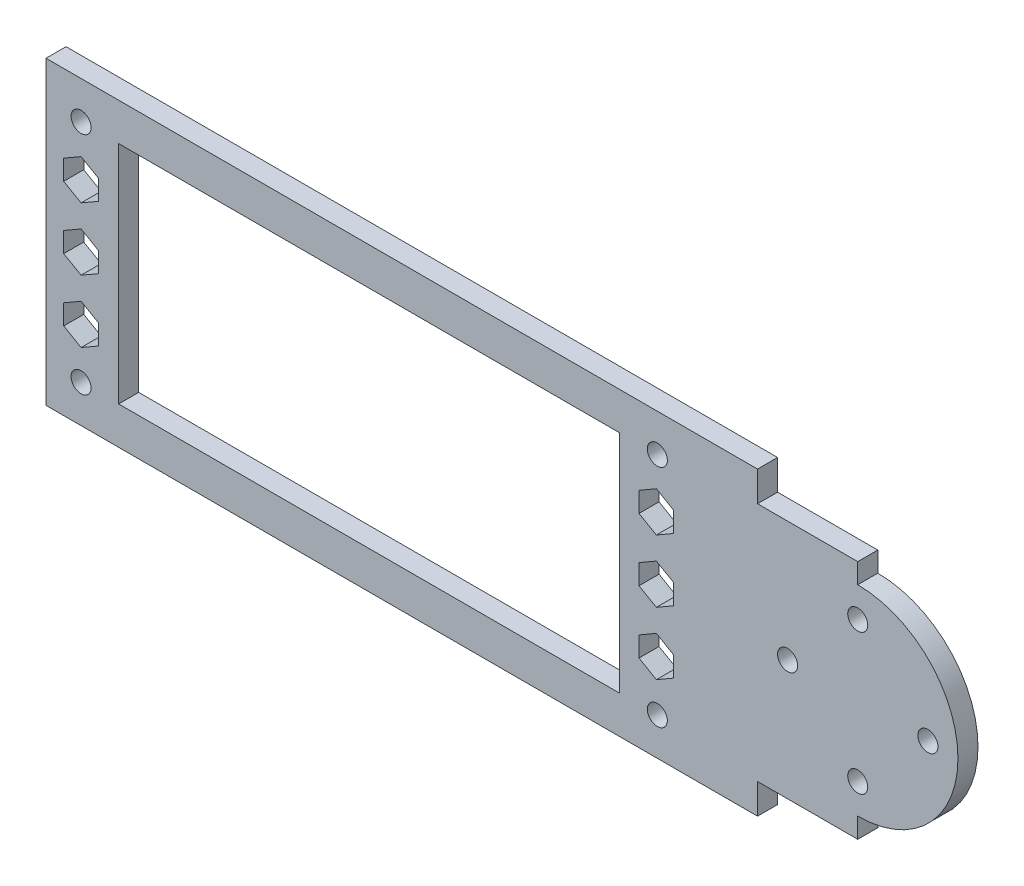
from build123d import *

# Parameters (mm, degrees)
SKETCH1_R           = 1
SKETCH1_W           = 50
SKETCH1_H           = 22.5
BOSS_EXTRUDE1_DEPTH = 2


with BuildPart() as part:
    # Sketch1 → Boss-Extrude1 (new body)
    with BuildSketch(Plane.XY):
        with BuildLine():
            Line((0, 10), (0, 12))
            Line((0, 12), (-10, 12))
            Line((-10, 12), (-10, 15))
            Line((-10, 15), (-81, 15))
            Line((-81, 15), (-81, -15))
            Line((-81, -15), (-10, -15))
            Line((-10, -15), (-10, -12))
            Line((-10, -12), (0, -12))
            Line((0, -12), (0, -10))
            ThreePointArc((0, -10), (10, 0), (0, 10))
        make_face()
        with Locations((0, 7)):
            Circle(SKETCH1_R, mode=Mode.SUBTRACT)
        with Locations((7, 0)):
            Circle(SKETCH1_R, mode=Mode.SUBTRACT)
        with Locations((0, -7)):
            Circle(SKETCH1_R, mode=Mode.SUBTRACT)
        with Locations((-7, 0)):
            Circle(SKETCH1_R, mode=Mode.SUBTRACT)
        with Locations((-20, 11.25)):
            Circle(SKETCH1_R, mode=Mode.SUBTRACT)
        with Locations((-20, -11.25)):
            Circle(SKETCH1_R, mode=Mode.SUBTRACT)
        with Locations((-77.5, 11.25)):
            Circle(SKETCH1_R, mode=Mode.SUBTRACT)
        with Locations((-77.5, -11.25)):
            Circle(SKETCH1_R, mode=Mode.SUBTRACT)
        with Locations((-48.75, 0)):
            Rectangle(SKETCH1_W, SKETCH1_H, mode=Mode.SUBTRACT)
        Polygon((-20.096394859, 8.25), (-21.828445667, 7.25), (-21.828445667, 5.25), (-20.096394859, 4.25), (-18.364344051, 5.25), (-18.364344051, 7.25), align=None, mode=Mode.SUBTRACT)
        Polygon((-20.096394859, -8.25), (-18.364344051, -7.25), (-18.364344051, -5.25), (-20.096394859, -4.25), (-21.828445667, -5.25), (-21.828445667, -7.25), align=None, mode=Mode.SUBTRACT)
        Polygon((-20.096394859, -2), (-18.364344051, -1), (-18.364344051, 1), (-20.096394859, 2), (-21.828445667, 1), (-21.828445667, -1), align=None, mode=Mode.SUBTRACT)
        Polygon((-77.5, 4.25), (-75.767949192, 5.25), (-75.767949192, 7.25), (-77.5, 8.25), (-79.232050808, 7.25), (-79.232050808, 5.25), align=None, mode=Mode.SUBTRACT)
        Polygon((-77.5, -8.25), (-75.767949192, -7.25), (-75.767949192, -5.25), (-77.5, -4.25), (-79.232050808, -5.25), (-79.232050808, -7.25), align=None, mode=Mode.SUBTRACT)
        Polygon((-77.5, -2), (-75.767949192, -1), (-75.767949192, 1), (-77.5, 2), (-79.232050808, 1), (-79.232050808, -1), align=None, mode=Mode.SUBTRACT)
    extrude(amount=BOSS_EXTRUDE1_DEPTH)


solid = part.part
